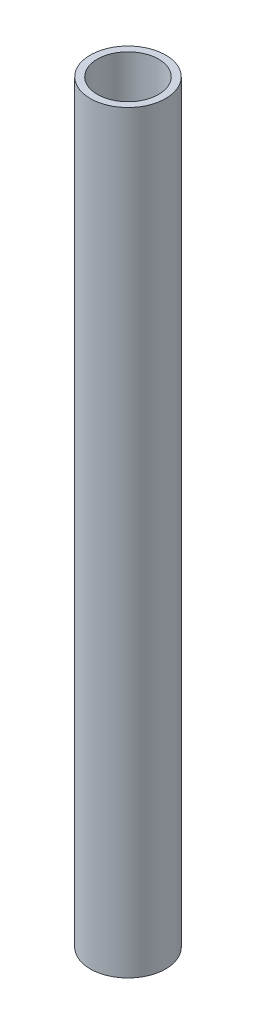
from build123d import *

# Parameters (mm, degrees)
SKETCH1_R           = 8
SKETCH1_R_2         = 6.5
BOSS_EXTRUDE1_DEPTH = 160


with BuildPart() as part:
    # Sketch1 → Boss-Extrude1 (new body)
    with BuildSketch(Plane(origin=(0, 0, 0), x_dir=(1, 0, 0), z_dir=(0, 1, 0))):
        with Locations(Location((0, 0, 0), (0, 0, 270))):
            Circle(SKETCH1_R)
        with Locations(Location((0, 0, 0), (0, 0, 270))):
            Circle(SKETCH1_R_2, mode=Mode.SUBTRACT)
    extrude(amount=BOSS_EXTRUDE1_DEPTH)


solid = part.part
